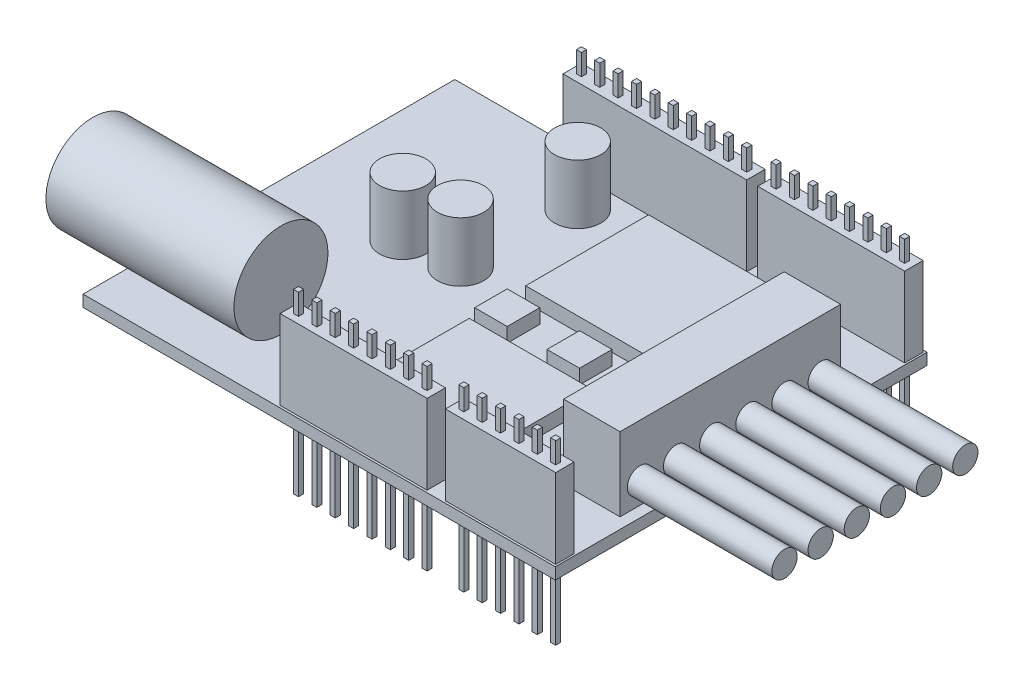
from build123d import *

# Parameters (mm, degrees)
ESQUISSE1_W             = 65.3
ESQUISSE1_H             = 51.4
BOSS_EXTRU_1_DEPTH      = 1.6
ESQUISSE2_W             = 17
ESQUISSE2_H             = 17
BOSS_EXTRU_2_DEPTH      = 2
BOSS_EXTRU_2_2_DEPTH    = 2
ESQUISSE2_W_2           = 4.5
ESQUISSE2_H_2           = 4.5
BOSS_EXTRU_2_3_DEPTH    = 2
BOSS_EXTRU_2_4_DEPTH    = 2
ESQUISSE3_R             = 3.2
BOSS_EXTRU_3_DEPTH      = 8.2
BOSS_EXTRU_3_2_DEPTH    = 8.2
BOSS_EXTRU_3_3_DEPTH    = 8.2
ESQUISSE4_W             = 7.8
ESQUISSE4_H             = 30.5
BOSS_EXTRU_4_DEPTH      = 10.2
ESQUISSE5_R             = 1.75
BOSS_EXTRU_5_DEPTH      = 20
BOSS_EXTRU_5_2_DEPTH    = 20
BOSS_EXTRU_5_3_DEPTH    = 20
BOSS_EXTRU_5_4_DEPTH    = 20
BOSS_EXTRU_5_5_DEPTH    = 20
BOSS_EXTRU_5_6_DEPTH    = 20
BOSS_EXTRU_6_DEPTH      = 6.5
BOSS_EXTRU_6_DEPTH_BACK = 19.5
ESQUISSE6_R             = 6.5
ESQUISSE7_W             = 20.32
ESQUISSE7_H             = 2.54
BOSS_EXTRU_7_DEPTH      = 11
ESQUISSE7_W_2           = 25.4
BOSS_EXTRU_7_2_DEPTH    = 11
ESQUISSE7_W_3           = 15.24
BOSS_EXTRU_7_3_DEPTH    = 11
BOSS_EXTRU_7_4_DEPTH    = 11
BOSS_EXTRU_8_DEPTH      = 9
BOSS_EXTRU_8_DEPTH_BACK = 15.5
ESQUISSE8_W             = 0.7
ESQUISSE8_H             = 0.7


with BuildPart() as part:
    # Esquisse1 → Boss.-Extru.1 (new body)
    with BuildSketch(Plane(origin=(0, 0, 0), x_dir=(1, 0, 0), z_dir=(0, 1, 0))):
        Rectangle(ESQUISSE1_W, ESQUISSE1_H)
    extrude(amount=BOSS_EXTRU_1_DEPTH)



with BuildPart() as body_2:
    # Esquisse2 → Boss.-Extru.2 (new body)
    with BuildSketch(Plane(origin=(0, 1.6, 0), x_dir=(1, 0, 0), z_dir=(0, 1, 0))):
        with Locations((7.45, 12.4)):
            Rectangle(ESQUISSE2_W, ESQUISSE2_H)
    extrude(amount=BOSS_EXTRU_2_DEPTH)


with BuildPart() as body_3:
    # Esquisse2 → Boss.-Extru.2 2 (new body)
    with BuildSketch(Plane(origin=(0, 1.6, 0), x_dir=(1, 0, 0), z_dir=(0, 1, 0))):
        with Locations((7.45, -12.4)):
            Rectangle(ESQUISSE2_W, ESQUISSE2_H)
    extrude(amount=BOSS_EXTRU_2_2_DEPTH)


with BuildPart() as body_4:
    # Esquisse2 → Boss.-Extru.2 3 (new body)
    with BuildSketch(Plane(origin=(0, 1.6, 0), x_dir=(1, 0, 0), z_dir=(0, 1, 0))):
        with Locations((0.3, 0)):
            Rectangle(ESQUISSE2_W_2, ESQUISSE2_H_2)
    extrude(amount=BOSS_EXTRU_2_3_DEPTH)


with BuildPart() as body_5:
    # Esquisse2 → Boss.-Extru.2 4 (new body)
    with BuildSketch(Plane(origin=(0, 1.6, 0), x_dir=(1, 0, 0), z_dir=(0, 1, 0))):
        with Locations((10.3, 0)):
            Rectangle(ESQUISSE2_W_2, ESQUISSE2_H_2)
    extrude(amount=BOSS_EXTRU_2_4_DEPTH)


with BuildPart() as body_6:
    # Esquisse3 → Boss.-Extru.3 (new body)
    with BuildSketch(Plane(origin=(0, 1.6, 0), x_dir=(1, 0, 0), z_dir=(0, 1, 0))):
        with Locations(Location((-8.55, 18.6, 0), (0, 0, 270))):
            Circle(ESQUISSE3_R)
    extrude(amount=BOSS_EXTRU_3_DEPTH)


with BuildPart() as body_7:
    # Esquisse3 → Boss.-Extru.3 2 (new body)
    with BuildSketch(Plane(origin=(0, 1.6, 0), x_dir=(1, 0, 0), z_dir=(0, 1, 0))):
        with Locations(Location((-9.75, 3.6, 0), (0, 0, 270))):
            Circle(ESQUISSE3_R)
    extrude(amount=BOSS_EXTRU_3_2_DEPTH)


with BuildPart() as body_8:
    # Esquisse3 → Boss.-Extru.3 3 (new body)
    with BuildSketch(Plane(origin=(0, 1.6, 0), x_dir=(1, 0, 0), z_dir=(0, 1, 0))):
        with Locations(Location((-16.95, 2.8, 0), (0, 0, 270))):
            Circle(ESQUISSE3_R)
    extrude(amount=BOSS_EXTRU_3_3_DEPTH)


with BuildPart() as body_9:
    # Esquisse4 → Boss.-Extru.4 (new body)
    with BuildSketch(Plane(origin=(0, 1.6, 0), x_dir=(1, 0, 0), z_dir=(0, 1, 0))):
        with Locations((27.25, 0)):
            Rectangle(ESQUISSE4_W, ESQUISSE4_H)
    extrude(amount=BOSS_EXTRU_4_DEPTH)


with BuildPart() as body_10:
    # Esquisse5 → Boss.-Extru.5 (new body)
    with BuildSketch(Plane(origin=(31.15, 0, 0), x_dir=(0, 0, -1), z_dir=(1, 0, 0))):
        with Locations((12.5, 4.6)):
            Circle(ESQUISSE5_R)
    extrude(amount=BOSS_EXTRU_5_DEPTH)


with BuildPart() as body_11:
    # Esquisse5 → Boss.-Extru.5 2 (new body)
    with BuildSketch(Plane(origin=(31.15, 0, 0), x_dir=(0, 0, -1), z_dir=(1, 0, 0))):
        with Locations((7.5, 4.6)):
            Circle(ESQUISSE5_R)
    extrude(amount=BOSS_EXTRU_5_2_DEPTH)


with BuildPart() as body_12:
    # Esquisse5 → Boss.-Extru.5 3 (new body)
    with BuildSketch(Plane(origin=(31.15, 0, 0), x_dir=(0, 0, -1), z_dir=(1, 0, 0))):
        with Locations((2.5, 4.6)):
            Circle(ESQUISSE5_R)
    extrude(amount=BOSS_EXTRU_5_3_DEPTH)


with BuildPart() as body_13:
    # Esquisse5 → Boss.-Extru.5 4 (new body)
    with BuildSketch(Plane(origin=(31.15, 0, 0), x_dir=(0, 0, -1), z_dir=(1, 0, 0))):
        with Locations((-2.5, 4.6)):
            Circle(ESQUISSE5_R)
    extrude(amount=BOSS_EXTRU_5_4_DEPTH)


with BuildPart() as body_14:
    # Esquisse5 → Boss.-Extru.5 5 (new body)
    with BuildSketch(Plane(origin=(31.15, 0, 0), x_dir=(0, 0, -1), z_dir=(1, 0, 0))):
        with Locations((-7.5, 4.6)):
            Circle(ESQUISSE5_R)
    extrude(amount=BOSS_EXTRU_5_5_DEPTH)


with BuildPart() as body_15:
    # Esquisse5 → Boss.-Extru.5 6 (new body)
    with BuildSketch(Plane(origin=(31.15, 0, 0), x_dir=(0, 0, -1), z_dir=(1, 0, 0))):
        with Locations((-12.5, 4.6)):
            Circle(ESQUISSE5_R)
    extrude(amount=BOSS_EXTRU_5_6_DEPTH)


with BuildPart() as body_16:
    # Esquisse6 → Boss.-Extru.6 (new, two sides: drawn at the far end of the back side and taken through both)
    with BuildSketch(Plane.ZY.offset(32.65).offset(-BOSS_EXTRU_6_DEPTH_BACK)):
        with Locations(Location((17.837314043, 9.090114105, 0), (0, 0, 180))):
            Circle(ESQUISSE6_R)
    extrude(amount=BOSS_EXTRU_6_DEPTH + BOSS_EXTRU_6_DEPTH_BACK)


with BuildPart() as body_17:
    # Esquisse7 → Boss.-Extru.7 (new body)
    with BuildSketch(Plane(origin=(0, 1.6, 0), x_dir=(1, 0, 0), z_dir=(0, 1, 0))):
        with Locations((22.24, 24.13)):
            Rectangle(ESQUISSE7_W, ESQUISSE7_H)
    extrude(amount=BOSS_EXTRU_7_DEPTH)


with BuildPart() as body_18:
    # Esquisse7 → Boss.-Extru.7 2 (new body)
    with BuildSketch(Plane(origin=(0, 1.6, 0), x_dir=(1, 0, 0), z_dir=(0, 1, 0))):
        with Locations((-2.14, 24.13)):
            Rectangle(ESQUISSE7_W_2, ESQUISSE7_H)
    extrude(amount=BOSS_EXTRU_7_2_DEPTH)


with BuildPart() as body_19:
    # Esquisse7 → Boss.-Extru.7 3 (new body)
    with BuildSketch(Plane(origin=(0, 1.6, 0), x_dir=(1, 0, 0), z_dir=(0, 1, 0))):
        with Locations((24.78, -24.13)):
            Rectangle(ESQUISSE7_W_3, ESQUISSE7_H)
    extrude(amount=BOSS_EXTRU_7_3_DEPTH)


with BuildPart() as body_20:
    # Esquisse7 → Boss.-Extru.7 4 (new body)
    with BuildSketch(Plane(origin=(0, 1.6, 0), x_dir=(1, 0, 0), z_dir=(0, 1, 0))):
        with Locations((4.46, -24.13)):
            Rectangle(ESQUISSE7_W, ESQUISSE7_H)
    extrude(amount=BOSS_EXTRU_7_4_DEPTH)


with BuildPart() as part_1:
    add(part.part)

    add(body_17.part)  # Boss.-Extru.8 merges body 17

    add(body_18.part)  # Boss.-Extru.8 merges body 18

    add(body_19.part)  # Boss.-Extru.8 merges body 19

    add(body_20.part)  # Boss.-Extru.8 merges body 20
    # Esquisse8 → Boss.-Extru.8 (add, two sides: drawn at the far end of the back side and taken through both)
    with BuildSketch(Plane.XZ.offset(-BOSS_EXTRU_8_DEPTH_BACK)):
        with Locations((13.35, -24.13)):
            Rectangle(ESQUISSE8_W, ESQUISSE8_H)
        with Locations((15.89, -24.13)):
            Rectangle(ESQUISSE8_W, ESQUISSE8_H)
        with Locations((18.43, -24.13)):
            Rectangle(ESQUISSE8_W, ESQUISSE8_H)
        with Locations((20.97, -24.13)):
            Rectangle(ESQUISSE8_W, ESQUISSE8_H)
        with Locations((23.51, -24.13)):
            Rectangle(ESQUISSE8_W, ESQUISSE8_H)
        with Locations((26.05, -24.13)):
            Rectangle(ESQUISSE8_W, ESQUISSE8_H)
        with Locations((28.59, -24.13)):
            Rectangle(ESQUISSE8_W, ESQUISSE8_H)
        with Locations((31.13, -24.13)):
            Rectangle(ESQUISSE8_W, ESQUISSE8_H)
        with Locations((9.29, -24.13)):
            Rectangle(ESQUISSE8_W, ESQUISSE8_H)
        with Locations((6.75, -24.13)):
            Rectangle(ESQUISSE8_W, ESQUISSE8_H)
        with Locations((4.21, -24.13)):
            Rectangle(ESQUISSE8_W, ESQUISSE8_H)
        with Locations((1.67, -24.13)):
            Rectangle(ESQUISSE8_W, ESQUISSE8_H)
        with Locations((-0.87, -24.13)):
            Rectangle(ESQUISSE8_W, ESQUISSE8_H)
        with Locations((-3.41, -24.13)):
            Rectangle(ESQUISSE8_W, ESQUISSE8_H)
        with Locations((-5.95, -24.13)):
            Rectangle(ESQUISSE8_W, ESQUISSE8_H)
        with Locations((-8.49, -24.13)):
            Rectangle(ESQUISSE8_W, ESQUISSE8_H)
        with Locations((-11.03, -24.13)):
            Rectangle(ESQUISSE8_W, ESQUISSE8_H)
        with Locations((-13.57, -24.13)):
            Rectangle(ESQUISSE8_W, ESQUISSE8_H)
        with Locations((18.43, 24.13)):
            Rectangle(ESQUISSE8_W, ESQUISSE8_H)
        with Locations((13.35, 24.13)):
            Rectangle(ESQUISSE8_W, ESQUISSE8_H)
        with Locations((20.97, 24.13)):
            Rectangle(ESQUISSE8_W, ESQUISSE8_H)
        with Locations((23.51, 24.13)):
            Rectangle(ESQUISSE8_W, ESQUISSE8_H)
        with Locations((26.05, 24.13)):
            Rectangle(ESQUISSE8_W, ESQUISSE8_H)
        with Locations((28.59, 24.13)):
            Rectangle(ESQUISSE8_W, ESQUISSE8_H)
        with Locations((31.13, 24.13)):
            Rectangle(ESQUISSE8_W, ESQUISSE8_H)
        with Locations((10.81, 24.13)):
            Rectangle(ESQUISSE8_W, ESQUISSE8_H)
        with Locations((8.27, 24.13)):
            Rectangle(ESQUISSE8_W, ESQUISSE8_H)
        with Locations((5.73, 24.13)):
            Rectangle(ESQUISSE8_W, ESQUISSE8_H)
        with Locations((3.19, 24.13)):
            Rectangle(ESQUISSE8_W, ESQUISSE8_H)
        with Locations((0.65, 24.13)):
            Rectangle(ESQUISSE8_W, ESQUISSE8_H)
        with Locations((-1.89, 24.13)):
            Rectangle(ESQUISSE8_W, ESQUISSE8_H)
        with Locations((-4.43, 24.13)):
            Rectangle(ESQUISSE8_W, ESQUISSE8_H)
    extrude(amount=BOSS_EXTRU_8_DEPTH + BOSS_EXTRU_8_DEPTH_BACK)


solid = Compound([body_2.part, body_3.part, body_4.part, body_5.part, body_6.part, body_7.part, body_8.part, body_9.part, body_10.part, body_11.part, body_12.part, body_13.part, body_14.part, body_15.part, body_16.part, part_1.part])
